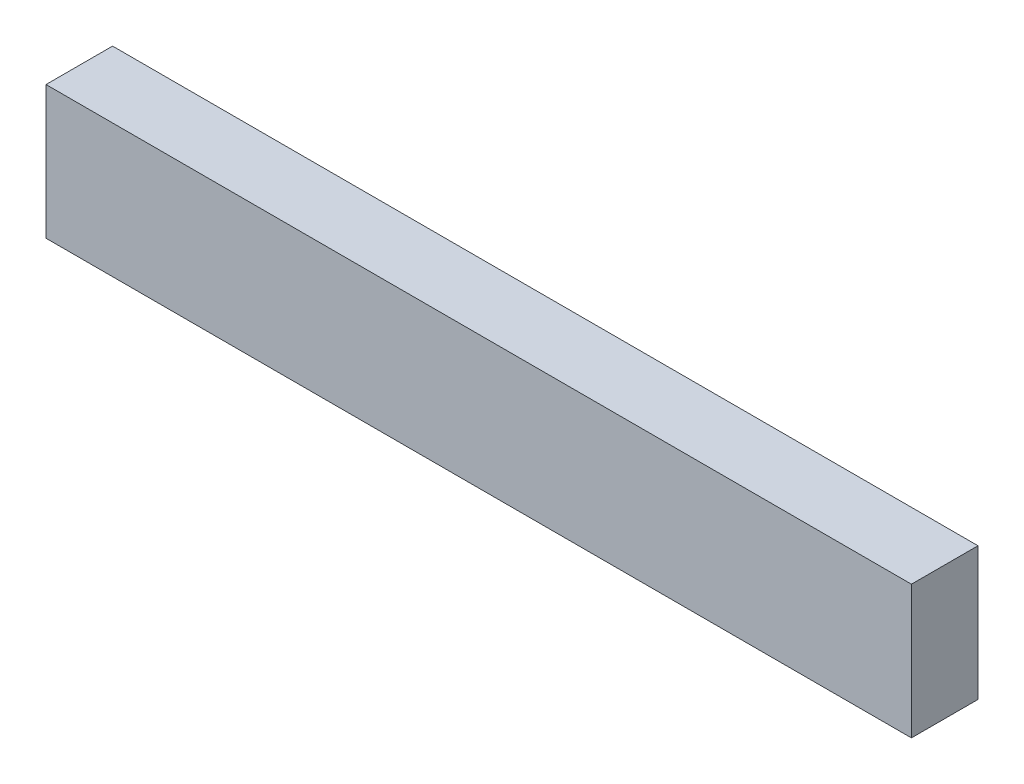
from build123d import *

# Parameters (mm, degrees)
SKETCH1_W           = 130
SKETCH1_H           = 20
BOSS_EXTRUDE1_DEPTH = 10


with BuildPart() as part:
    # Sketch1 → Boss-Extrude1 (new body)
    with BuildSketch(Plane.XY):
        Rectangle(SKETCH1_W, SKETCH1_H)
    extrude(amount=BOSS_EXTRUDE1_DEPTH)


solid = part.part
